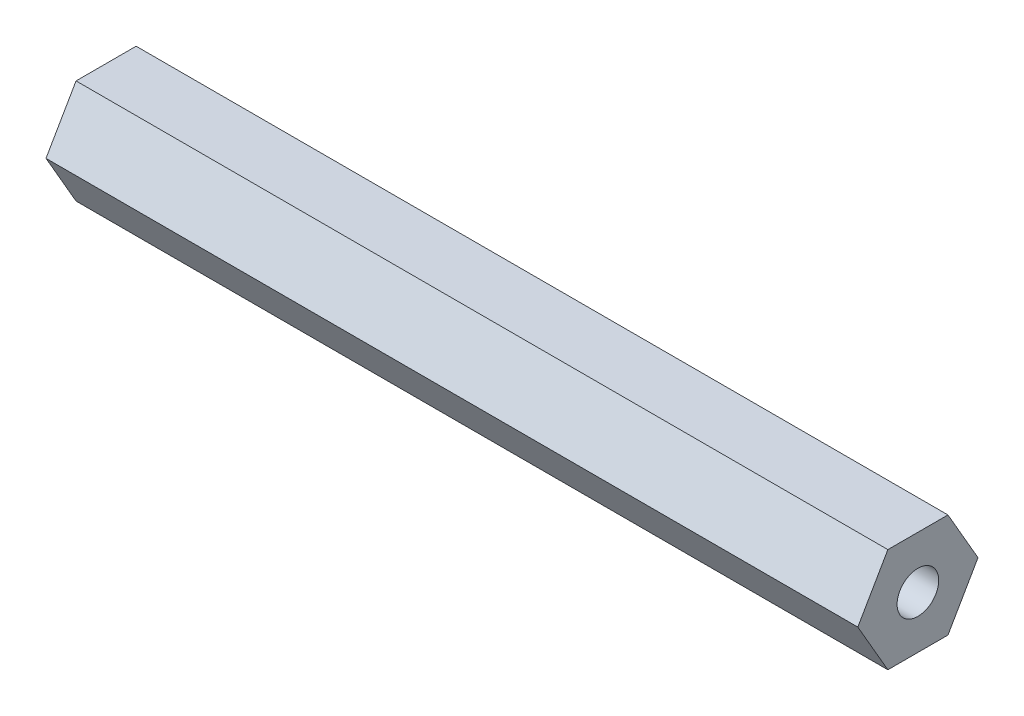
from build123d import *

# Parameters (mm, degrees)
SKETCH_1_R      = 1
EXTRUDE_1_DEPTH = 39


with BuildPart() as part:
    # 草图1 → 凸台-拉伸1 (new body)
    with BuildSketch(Plane(origin=(0, 0, 0), x_dir=(0, 0, -1), z_dir=(1, 0, 0))):
        Polygon((2.886751346, 0), (1.443375673, 2.5), (-1.443375673, 2.5), (-2.886751346, 0), (-1.443375673, -2.5), (1.443375673, -2.5), align=None)
        Circle(SKETCH_1_R, mode=Mode.SUBTRACT)
    extrude(amount=EXTRUDE_1_DEPTH)


solid = part.part
